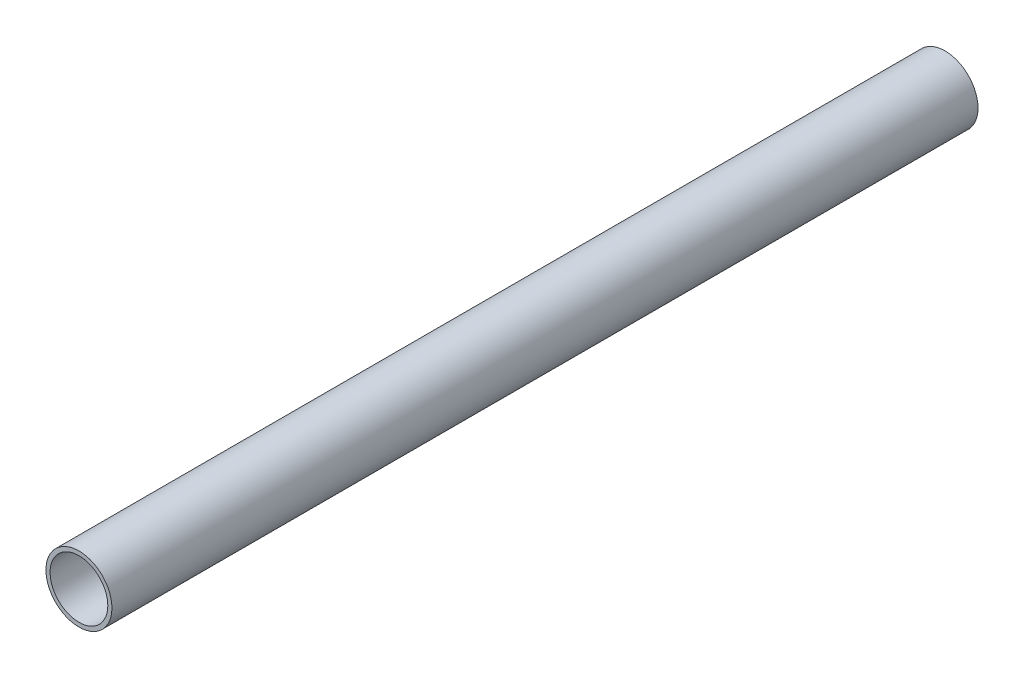
from build123d import *

# Parameters (mm, degrees)
SKETCH_1_R      = 4
SKETCH_1_R_2    = 3.5
EXTRUDE_1_DEPTH = 105


with BuildPart() as part:
    # 草图1 → 凸台-拉伸1 (new body)
    with BuildSketch(Plane.XY):
        Circle(SKETCH_1_R)
        Circle(SKETCH_1_R_2, mode=Mode.SUBTRACT)
    extrude(amount=EXTRUDE_1_DEPTH)


solid = part.part
